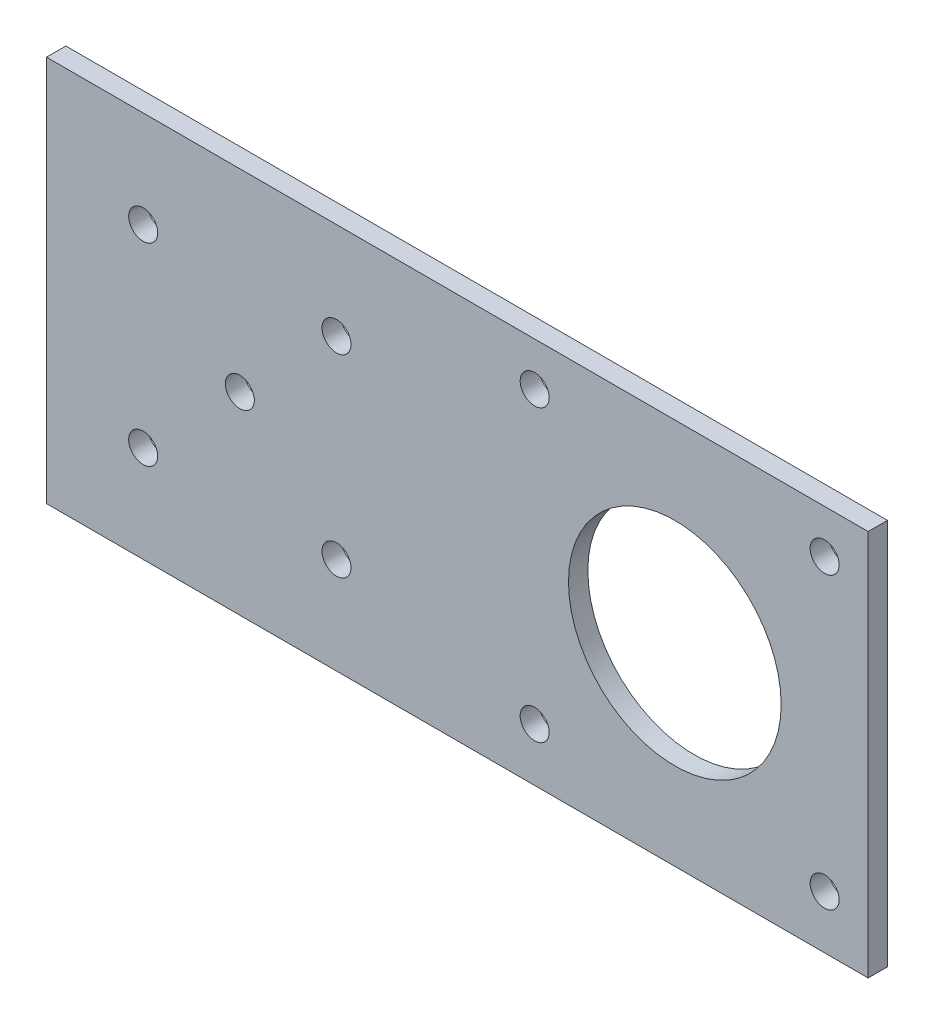
from build123d import *

# Parameters (mm, degrees)
SKETCH1_W           = 85
SKETCH1_H           = 40
BOSS_EXTRUDE1_DEPTH = 1
SKETCH2_R           = 11
SKETCH2_R_2         = 1.5
CUT_EXTRUDE1_DEPTH  = 2
SKETCH3_R           = 1.5
CUT_EXTRUDE2_DEPTH  = 10


with BuildPart() as part:
    # Sketch1 → Boss-Extrude1 (new, symmetric)
    with BuildSketch(Plane.XY):
        Rectangle(SKETCH1_W, SKETCH1_H)
    extrude(amount=BOSS_EXTRUDE1_DEPTH, both=True)

    # Sketch2 → Cut-Extrude1 (cut)
    with BuildSketch(Plane.XY.offset(1)):
        with Locations((22.5, 0)):
            Circle(SKETCH2_R)
        with Locations((-22.5, 0)):
            Circle(SKETCH2_R_2)
        with Locations((-32.5, 10)):
            Circle(SKETCH2_R_2)
        with Locations((-12.5, 10)):
            Circle(SKETCH2_R_2)
        with Locations((-12.5, -10)):
            Circle(SKETCH2_R_2)
        with Locations((-32.5, -10)):
            Circle(SKETCH2_R_2)
    extrude(amount=-CUT_EXTRUDE1_DEPTH, mode=Mode.SUBTRACT)

    # Sketch3 → Cut-Extrude2 (cut)
    with BuildSketch(Plane.XY.offset(1)):
        with Locations((8, 15.5)):
            Circle(SKETCH3_R)
        with Locations((38, 15.5)):
            Circle(SKETCH3_R)
        with Locations((38, -14.5)):
            Circle(SKETCH3_R)
        with Locations((8, -14.5)):
            Circle(SKETCH3_R)
    extrude(amount=-CUT_EXTRUDE2_DEPTH, mode=Mode.SUBTRACT)


solid = part.part
